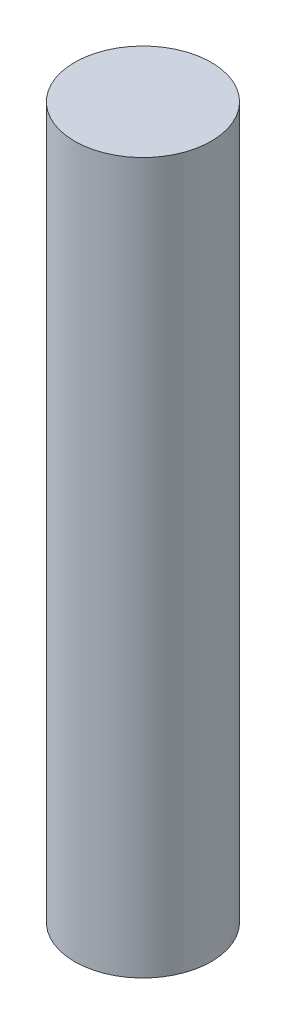
from build123d import *

# Parameters (mm, degrees)
SKETCH_1_R      = 7.5
EXTRUDE_1_DEPTH = 78


with BuildPart() as part:
    # 草图1 → 凸台-拉伸1 (new body)
    with BuildSketch(Plane(origin=(0, 0, 0), x_dir=(1, 0, 0), z_dir=(0, 1, 0))):
        with Locations(Location((0, 0, 0), (0, 0, 270))):
            Circle(SKETCH_1_R)
    extrude(amount=EXTRUDE_1_DEPTH)


solid = part.part
